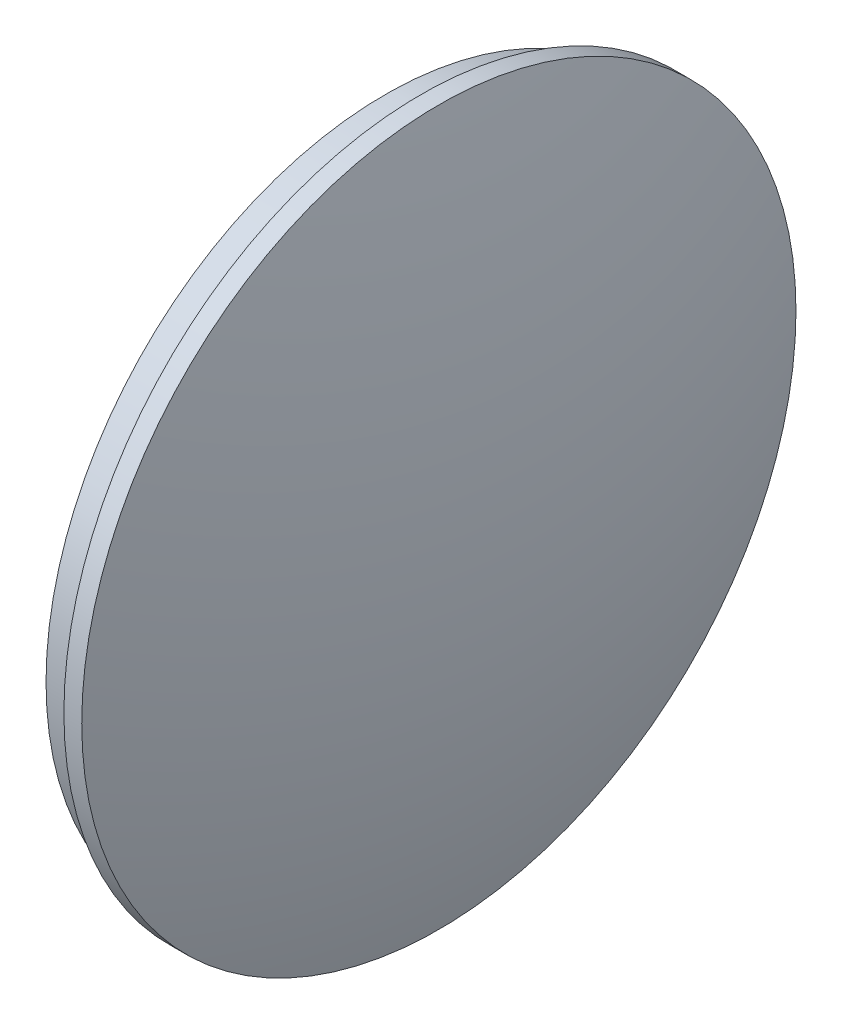
from build123d import *

# Parameters (mm, degrees)
DOME1_FACE_RADIUS = 20
DOME1_HEIGHT      = 3


with BuildPart() as part:
    # Sketch1 → Revolve1 (revolve)
    with BuildSketch(Plane.XY, mode=Mode.PRIVATE) as revolve1_sk:
        Polygon((0, 0), (0, 20), (-1, 20), (-1, 19), (-3, 19), (-3, 0), align=None)
    revolve(revolve1_sk.sketch.rotate(Axis((-3, 0, 0), (1, 0, 0)), 90), axis=Axis((-3, 0, 0), (1, 0, 0)))

    # Dome1: a dome of height H over a round flat face of radius A is a cap of a sphere of radius (A * A + H * H) / (2 * H)
    dome1_r = (DOME1_FACE_RADIUS * DOME1_FACE_RADIUS + DOME1_HEIGHT * DOME1_HEIGHT) / (2 * DOME1_HEIGHT)
    dome1_base = Plane((0, 0, 0), z_dir=(1, 0, 0))
    with Locations(dome1_base.offset(DOME1_HEIGHT - dome1_r)):
        dome1_ball = Sphere(dome1_r, mode=Mode.PRIVATE)
    add(split(dome1_ball, bisect_by=dome1_base, keep=Keep.TOP, mode=Mode.PRIVATE))


solid = part.part
